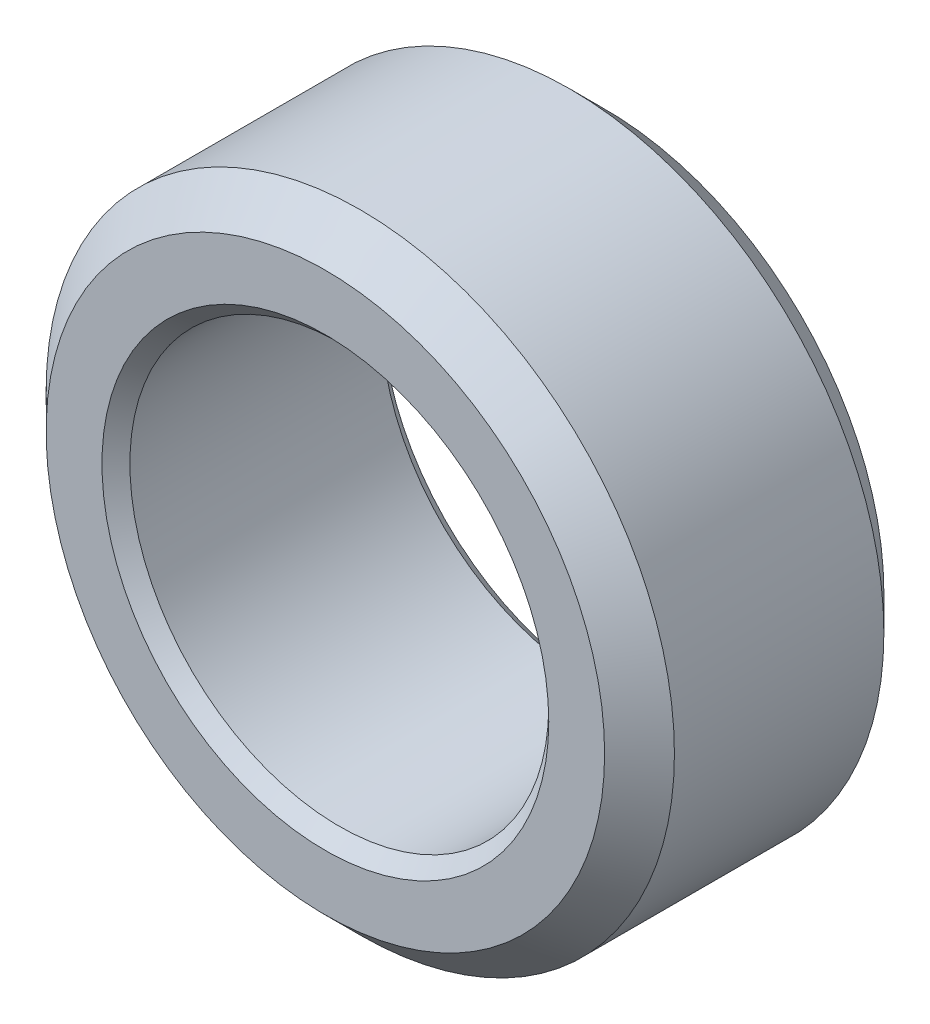
from build123d import *

# Parameters (mm, degrees)
ESQUISSE1_R          = 4.5
ESQUISSE1_R_2        = 3
BASE_EXTRUSION_DEPTH = 2
CHANFREIN1_SIZE      = 0.5
CHANFREIN2_SIZE      = 0.2


with BuildPart() as part:
    # Esquisse1 → Base-Extrusion (new, symmetric)
    with BuildSketch(Plane.XY):
        Circle(ESQUISSE1_R)
        Circle(ESQUISSE1_R_2, mode=Mode.SUBTRACT)
    extrude(amount=BASE_EXTRUSION_DEPTH, both=True)

    # Chanfrein1
    chanfrein1_edges = [part.edges().sort_by_distance(p)[0] for p in [
        (-4.5, 0, -2),
        (-4.5, 0, 2),
    ]]
    chamfer(chanfrein1_edges, length=CHANFREIN1_SIZE)

    # Chanfrein2
    chanfrein2_edges = [part.edges().sort_by_distance(p)[0] for p in [
        (-3, 0, -2),
        (-3, 0, 2),
    ]]
    chamfer(chanfrein2_edges, length=CHANFREIN2_SIZE)


solid = part.part
